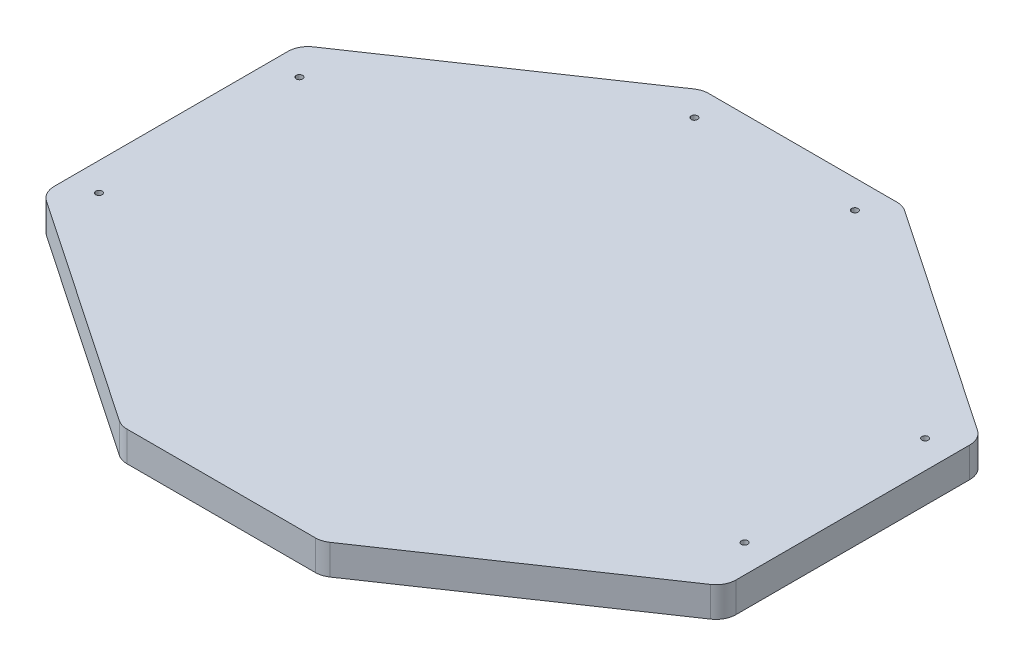
from build123d import *

# Parameters (mm, degrees)
BOSS_EXTRU_1_DEPTH       = 15
CONG_10_R                = 10
ENL_V_MAT_EXTRU_13_REACH = 393.106
ESQUISSE13_W             = 20
ESQUISSE13_H             = 143.033455182
ESQUISSE13_H_2           = 181.308681646
CONG_12_R                = 10
ENL_V_MAT_EXTRU_14_REACH = 377.805
ESQUISSE14_R             = 1.6


with BuildPart() as part:
    # Esquisse1 → Boss.-Extru.1 (new body)
    with BuildSketch(Plane(origin=(0, 0, 0), x_dir=(1, 0, 0), z_dir=(0, 1, 0))):
        Polygon((-76.643189126, -51.401333399), (63.356810874, 43.598666601), (163.356810874, 43.598666601), (303.356810874, -51.401333399), (303.356810874, -151.401333399), (163.356810874, -246.401333399), (63.356810874, -246.401333399), (-76.643189126, -151.401333399), align=None)
    extrude(amount=BOSS_EXTRU_1_DEPTH)

    # Congé10
    cong_10_edges = [part.edges().sort_by_distance(p)[0] for p in [
        (-76.643189126, 7.5, 51.401333399),
        (63.356810874, 7.5, -43.598666601),
        (163.356810874, 7.5, -43.598666601),
        (303.356810874, 7.5, 51.401333399),
        (303.356810874, 7.5, 151.401333399),
        (163.356810874, 7.5, 246.401333399),
        (63.356810874, 7.5, 246.401333399),
        (-76.643189126, 7.5, 151.401333399),
    ]]
    fillet(cong_10_edges, radius=CONG_10_R)

    # Esquisse13 → Enlèv. mat.-Extru.13 (cut, up to next)
    with BuildSketch(Plane(origin=(0, 15, 0), x_dir=(1, 0, 0), z_dir=(0, 1, 0)), mode=Mode.PRIVATE) as enl_v_mat_extru_13_sk1:
        with Locations((-66.643189126, -101.968599131)):
            Rectangle(ESQUISSE13_W, ESQUISSE13_H)
    enl_v_mat_extru_13_tool1 = extrude(enl_v_mat_extru_13_sk1.sketch, amount=-ENL_V_MAT_EXTRU_13_REACH, mode=Mode.PRIVATE) & part.part
    # Esquisse13 → Enlèv. mat.-Extru.13 (cut, up to next)
    with BuildSketch(Plane(origin=(0, 15, 0), x_dir=(1, 0, 0), z_dir=(0, 1, 0)), mode=Mode.PRIVATE) as enl_v_mat_extru_13_sk2:
        with Locations((293.356810874, -101.059068944)):
            Rectangle(ESQUISSE13_W, ESQUISSE13_H_2)
    enl_v_mat_extru_13_tool2 = extrude(enl_v_mat_extru_13_sk2.sketch, amount=-ENL_V_MAT_EXTRU_13_REACH, mode=Mode.PRIVATE) & part.part
    add(enl_v_mat_extru_13_tool1.solids().sort_by_distance((-66.643189, 15, 101.968599))[0], mode=Mode.SUBTRACT)
    add(enl_v_mat_extru_13_tool2.solids().sort_by_distance((293.356811, 15, 101.059069))[0], mode=Mode.SUBTRACT)

    # Congé12
    cong_12_edges = [part.edges().sort_by_distance(p)[0] for p in [
        (-56.643189126, 7.5, 37.829904828),
        (-56.643189126, 7.5, 164.97276197),
        (283.356810874, 7.5, 37.829904828),
        (283.356810874, 7.5, 164.97276197),
    ]]
    fillet(cong_12_edges, radius=CONG_12_R)

    # Esquisse14 → Enlèv. mat.-Extru.14 (cut, up to next)
    with BuildSketch(Plane(origin=(0, 15, 0), x_dir=(1, 0, 0), z_dir=(0, 1, 0)), mode=Mode.PRIVATE) as enl_v_mat_extru_14_sk1:
        with Locations(Location((-42.643189126, -51.403530316, 0), (0, 0, 270))):
            Circle(ESQUISSE14_R)
    enl_v_mat_extru_14_tool1 = extrude(enl_v_mat_extru_14_sk1.sketch, amount=-ENL_V_MAT_EXTRU_14_REACH, mode=Mode.PRIVATE) & part.part
    # Esquisse14 → Enlèv. mat.-Extru.14 (cut, up to next)
    with BuildSketch(Plane(origin=(0, 15, 0), x_dir=(1, 0, 0), z_dir=(0, 1, 0)), mode=Mode.PRIVATE) as enl_v_mat_extru_14_sk2:
        with Locations(Location((-42.643189126, -151.403530316, 0), (0, 0, 270))):
            Circle(ESQUISSE14_R)
    enl_v_mat_extru_14_tool2 = extrude(enl_v_mat_extru_14_sk2.sketch, amount=-ENL_V_MAT_EXTRU_14_REACH, mode=Mode.PRIVATE) & part.part
    # Esquisse14 → Enlèv. mat.-Extru.14 (cut, up to next)
    with BuildSketch(Plane(origin=(0, 15, 0), x_dir=(1, 0, 0), z_dir=(0, 1, 0)), mode=Mode.PRIVATE) as enl_v_mat_extru_14_sk3:
        with Locations(Location((73.359258963, 29.598666601, 0), (0, 0, 270))):
            Circle(ESQUISSE14_R)
    enl_v_mat_extru_14_tool3 = extrude(enl_v_mat_extru_14_sk3.sketch, amount=-ENL_V_MAT_EXTRU_14_REACH, mode=Mode.PRIVATE) & part.part
    # Esquisse14 → Enlèv. mat.-Extru.14 (cut, up to next)
    with BuildSketch(Plane(origin=(0, 15, 0), x_dir=(1, 0, 0), z_dir=(0, 1, 0)), mode=Mode.PRIVATE) as enl_v_mat_extru_14_sk4:
        with Locations(Location((153.359258963, 29.598666601, 0), (0, 0, 270))):
            Circle(ESQUISSE14_R)
    enl_v_mat_extru_14_tool4 = extrude(enl_v_mat_extru_14_sk4.sketch, amount=-ENL_V_MAT_EXTRU_14_REACH, mode=Mode.PRIVATE) & part.part
    # Esquisse14 → Enlèv. mat.-Extru.14 (cut, up to next)
    with BuildSketch(Plane(origin=(0, 15, 0), x_dir=(1, 0, 0), z_dir=(0, 1, 0)), mode=Mode.PRIVATE) as enl_v_mat_extru_14_sk5:
        with Locations(Location((269.356810874, -51.399136482, 0), (0, 0, 270))):
            Circle(ESQUISSE14_R)
    enl_v_mat_extru_14_tool5 = extrude(enl_v_mat_extru_14_sk5.sketch, amount=-ENL_V_MAT_EXTRU_14_REACH, mode=Mode.PRIVATE) & part.part
    # Esquisse14 → Enlèv. mat.-Extru.14 (cut, up to next)
    with BuildSketch(Plane(origin=(0, 15, 0), x_dir=(1, 0, 0), z_dir=(0, 1, 0)), mode=Mode.PRIVATE) as enl_v_mat_extru_14_sk6:
        with Locations(Location((269.356810874, -141.399136482, 0), (0, 0, 270))):
            Circle(ESQUISSE14_R)
    enl_v_mat_extru_14_tool6 = extrude(enl_v_mat_extru_14_sk6.sketch, amount=-ENL_V_MAT_EXTRU_14_REACH, mode=Mode.PRIVATE) & part.part
    add(enl_v_mat_extru_14_tool1.solids().sort_by_distance((-42.643189, 15, 51.40353))[0], mode=Mode.SUBTRACT)
    add(enl_v_mat_extru_14_tool2.solids().sort_by_distance((-42.643189, 15, 151.40353))[0], mode=Mode.SUBTRACT)
    add(enl_v_mat_extru_14_tool3.solids().sort_by_distance((73.359259, 15, -29.598667))[0], mode=Mode.SUBTRACT)
    add(enl_v_mat_extru_14_tool4.solids().sort_by_distance((153.359259, 15, -29.598667))[0], mode=Mode.SUBTRACT)
    add(enl_v_mat_extru_14_tool5.solids().sort_by_distance((269.356811, 15, 51.399136))[0], mode=Mode.SUBTRACT)
    add(enl_v_mat_extru_14_tool6.solids().sort_by_distance((269.356811, 15, 141.399136))[0], mode=Mode.SUBTRACT)


solid = part.part
